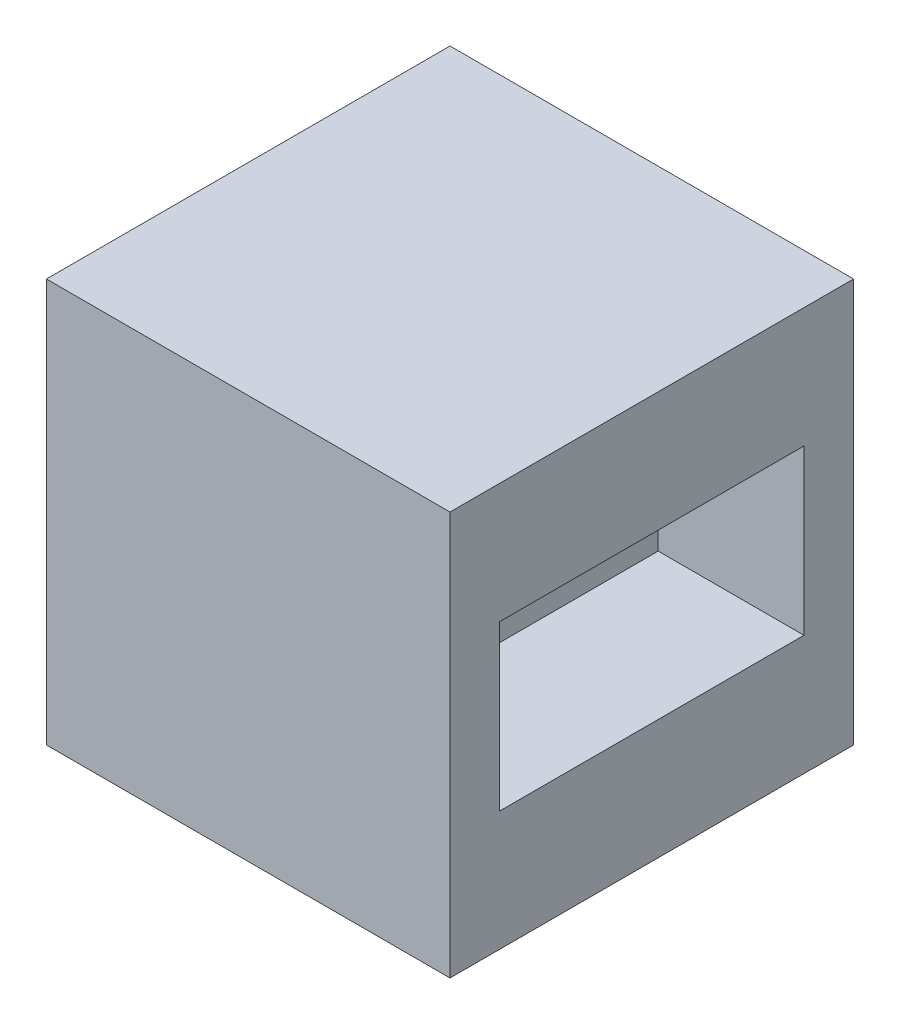
from build123d import *

# Parameters (mm, degrees)
SKETCH1_W           = 30
SKETCH1_H           = 30
BOSS_EXTRUDE1_DEPTH = 30
SKETCH2_W           = 11.315
SKETCH2_H           = 6.095
CUT_EXTRUDE1_DEPTH  = 10.84
SKETCH3_W           = 20
SKETCH3_H           = 6
CUT_EXTRUDE4_DEPTH  = 2


with BuildPart() as part:
    # Sketch1 → Boss-Extrude1 (new body)
    with BuildSketch(Plane.XY):
        with Locations((15, -15)):
            Rectangle(SKETCH1_W, SKETCH1_H)
    extrude(amount=BOSS_EXTRUDE1_DEPTH)

    # Sketch2 → Cut-Extrude1 (cut)
    with BuildSketch(Plane(origin=(30, 0, 0), x_dir=(0, 0, -1), z_dir=(1, 0, 0))):
        with Locations((-20.6575, -18.0475)):
            Rectangle(SKETCH2_W, SKETCH2_H)
        Polygon((-3.685, -8.905), (-26.315, -8.905), (-26.315, -15), (-15, -15), (-3.685, -15), align=None)
        with Locations((-9.3425, -18.0475)):
            Rectangle(SKETCH2_W, SKETCH2_H)
    extrude(amount=-CUT_EXTRUDE1_DEPTH, mode=Mode.SUBTRACT)

    # Sketch3 → Cut-Extrude4 (cut)
    with BuildSketch(Plane.XZ.offset(30)):
        with Locations((14.938029793, 15.294097389)):
            Rectangle(SKETCH3_W, SKETCH3_H)
    extrude(amount=-CUT_EXTRUDE4_DEPTH, mode=Mode.SUBTRACT)


solid = part.part
